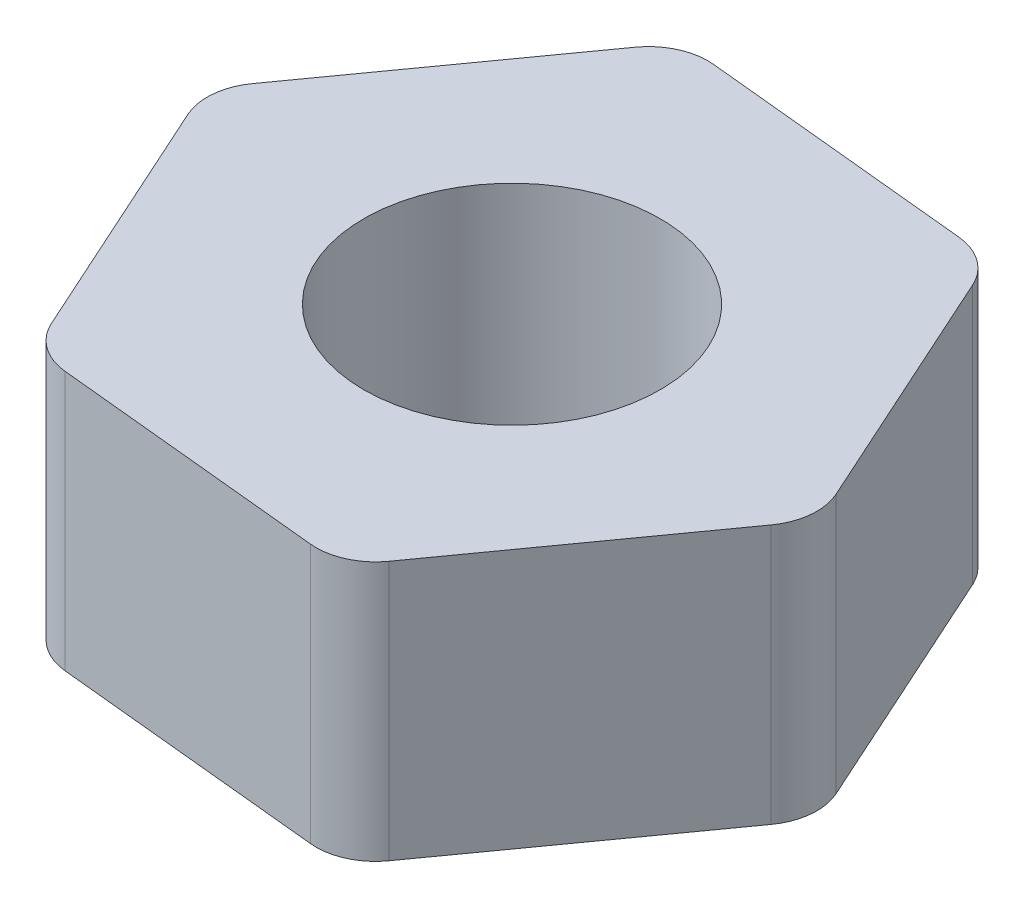
from build123d import *

# Parameters (mm, degrees)
BOSS_EXTRUDE1_DEPTH = 1.75
FILLET1_R           = 0.4
SKETCH7_R           = 1
CUT_EXTRUDE1_DEPTH  = 4.523215893


with BuildPart() as part:
    # Sketch1 → Boss-Extrude1 (new body)
    with BuildSketch(Plane(origin=(0, 0, 0), x_dir=(1, 0, 0), z_dir=(0, 1, 0))):
        Polygon((0.952315216, -2.103908045), (2.298195422, -0.227224853), (1.345880206, 1.876683192), (-0.952315216, 2.103908045), (-2.298195422, 0.227224853), (-1.345880206, -1.876683192), align=None)
    extrude(amount=BOSS_EXTRUDE1_DEPTH)

    # Fillet1
    fillet1_edges = [part.edges().sort_by_distance(p)[0] for p in [
        (-1.345880206, 0.875, 1.876683192),
        (-2.298195422, 0.875, -0.227224853),
        (-0.952315216, 0.875, -2.103908045),
        (1.345880206, 0.875, -1.876683192),
        (2.298195422, 0.875, 0.227224853),
        (0.952315216, 0.875, 2.103908045),
    ]]
    fillet(fillet1_edges, radius=FILLET1_R)

    # Sketch7 → Cut-Extrude1 (cut, through all)
    with BuildSketch(Plane(origin=(0, 0, 0), x_dir=(1, 0, 0), z_dir=(0, 1, 0))):
        with Locations(Location((0, 0, 0), (0, 0, 270))):
            Circle(SKETCH7_R)
    extrude(amount=CUT_EXTRUDE1_DEPTH, mode=Mode.SUBTRACT)


solid = part.part
